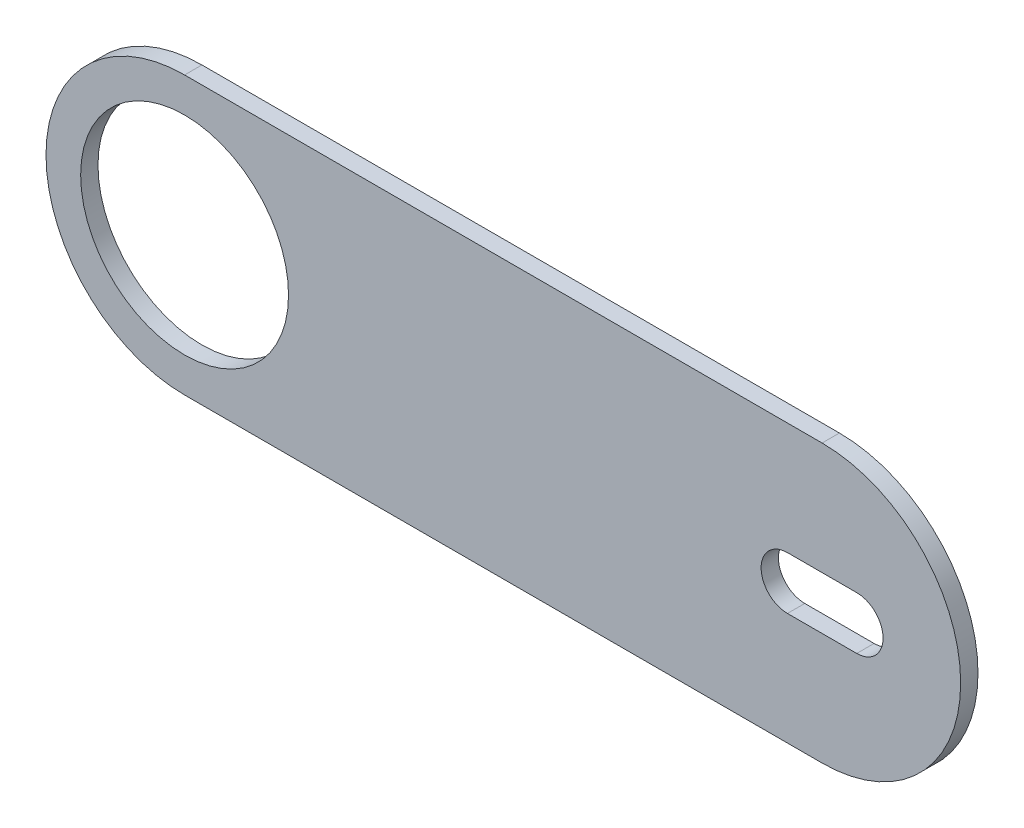
from build123d import *

# Parameters (mm, degrees)
SKETCH1_R           = 9.525
BOSS_EXTRUDE1_DEPTH = 1.5875


with BuildPart() as part:
    # Sketch1 → Boss-Extrude1 (new body)
    with BuildSketch(Plane.XY):
        with BuildLine():
            Line((-29.21, 12.7), (29.21, 12.7))
            ThreePointArc((29.21, 12.7), (41.91, 0), (29.21, -12.7))
            Line((29.21, -12.7), (-29.21, -12.7))
            ThreePointArc((-29.21, -12.7), (-41.91, 0), (-29.21, 12.7))
        make_face()
        with Locations((-29.21, 0)):
            Circle(SKETCH1_R, mode=Mode.SUBTRACT)
        with BuildLine():
            Line((32.385, -2.413), (26.035, -2.413))
            ThreePointArc((26.035, -2.413), (23.622, 0), (26.035, 2.413))
            Line((26.035, 2.413), (32.385, 2.413))
            ThreePointArc((32.385, 2.413), (34.798, 0), (32.385, -2.413))
        make_face(mode=Mode.SUBTRACT)
    extrude(amount=BOSS_EXTRUDE1_DEPTH)


solid = part.part
